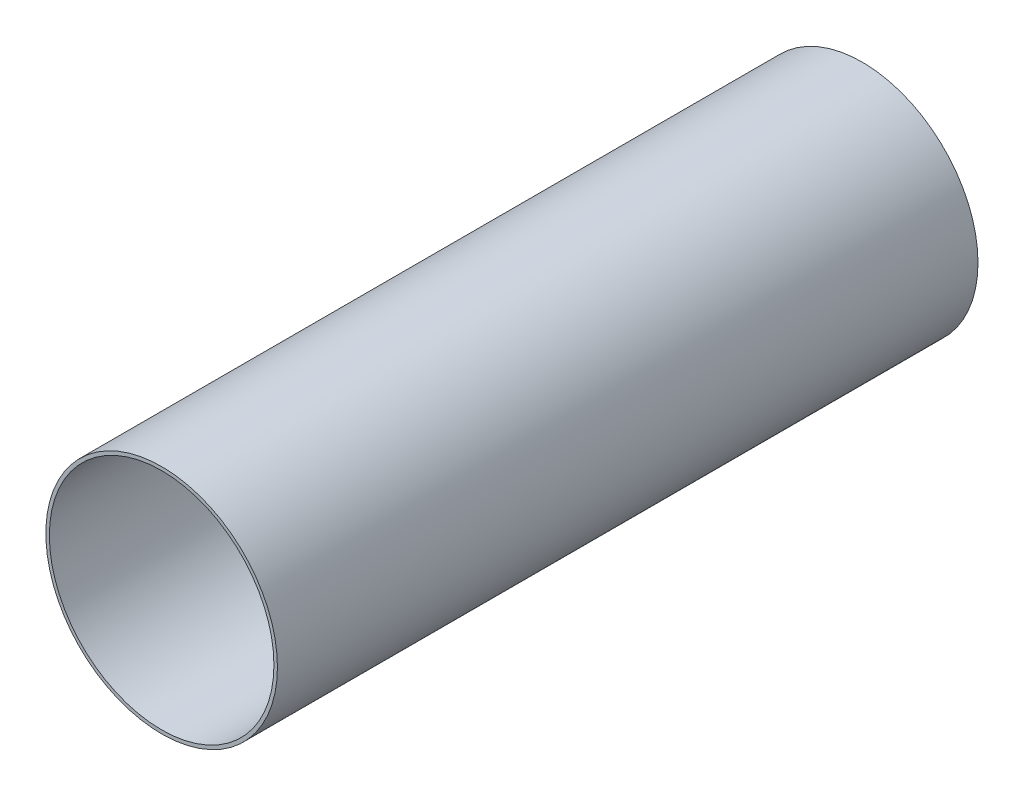
from build123d import *

# Parameters (mm, degrees)
SKETCH1_R           = 32.5374
SKETCH1_R_2         = 31.55315
BOSS_EXTRUDE1_DEPTH = 196.85


with BuildPart() as part:
    # Sketch1 → Boss-Extrude1 (new body)
    with BuildSketch(Plane.XY):
        Circle(SKETCH1_R)
        Circle(SKETCH1_R_2, mode=Mode.SUBTRACT)
    extrude(amount=BOSS_EXTRUDE1_DEPTH)


solid = part.part
